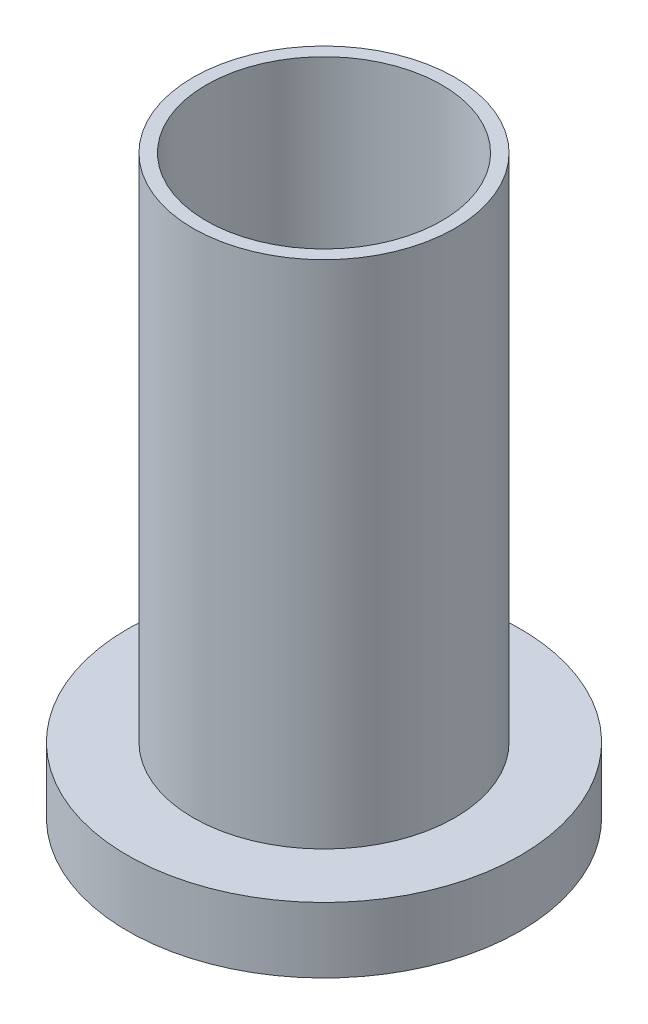
from build123d import *

# Parameters (mm, degrees)
SKETCH_2_R          = 0.9
CUT_EXTRUDE_1_DEPTH = 3.9


with BuildPart() as part:
    # ｽｹｯﾁ1 → 回転1 (revolve)
    with BuildSketch(Plane.XY):
        Polygon((0, 0), (0, 0.5), (0.5, 0.5), (0.5, 4.4), (1.5, 4.4), (1.5, 0), align=None)
    revolve(axis=Axis((1.5, 4.4, 0), (0, -1, 0)))

    # ｽｹｯﾁ2 → ｶｯﾄ - 押し出し1 (cut)
    with BuildSketch(Plane(origin=(0, 4.4, 0), x_dir=(1, 0, 0), z_dir=(0, 1, 0))):
        with Locations(Location((1.5, 0, 0), (0, 0, 180))):
            Circle(SKETCH_2_R)
    extrude(amount=-CUT_EXTRUDE_1_DEPTH, mode=Mode.SUBTRACT)


solid = part.part
